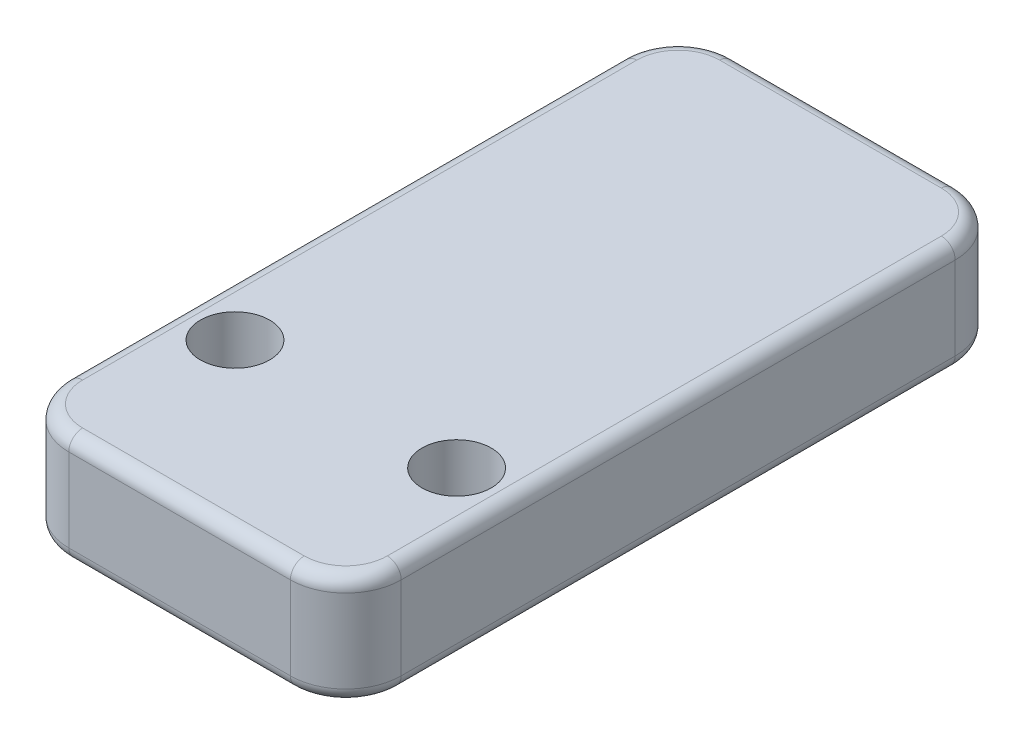
from build123d import *

# Parameters (mm, degrees)
SKETCH1_W           = 24
SKETCH1_H           = 48
BOSS_EXTRUDE1_DEPTH = 8
FILLET2_R           = 4
SKETCH2_R           = 2.5
CUT_EXTRUDE1_DEPTH  = 8
FILLET3_R           = 1


with BuildPart() as part:
    # Sketch1 → Boss-Extrude1 (new body)
    with BuildSketch(Plane(origin=(0, 0, 0), x_dir=(1, 0, 0), z_dir=(0, 1, 0))):
        Rectangle(SKETCH1_W, SKETCH1_H)
    extrude(amount=BOSS_EXTRUDE1_DEPTH)

    # Fillet2
    fillet2_edges = [part.edges().sort_by_distance(p)[0] for p in [
        (-12, 4, 24),
        (-12, 4, -24),
        (12, 4, -24),
        (12, 4, 24),
    ]]
    fillet(fillet2_edges, radius=FILLET2_R)

    # Sketch2 → Cut-Extrude1 (cut)
    with BuildSketch(Plane(origin=(0, 8, 0), x_dir=(1, 0, 0), z_dir=(0, 1, 0))):
        with Locations(Location((8, -12, 0), (0, 0, 270))):
            Circle(SKETCH2_R)
        with Locations(Location((-8, -12, 0), (0, 0, 270))):
            Circle(SKETCH2_R)
    extrude(amount=-CUT_EXTRUDE1_DEPTH, mode=Mode.SUBTRACT)

    # Fillet3
    fillet3_edges = [part.edges().sort_by_distance(p)[0] for p in [
        (0, 0, 24),
        (0, 8, 24),
        (-12, 0, 0),
        (0, 0, -24),
        (12, 0, 0),
        (10.828427125, 0, -22.828427125),
        (10.828427125, 0, 22.828427125),
        (-10.828427125, 0, -22.828427125),
        (-10.828427125, 0, 22.828427125),
        (-12, 8, 0),
        (12, 8, 0),
        (0, 8, -24),
        (10.828427125, 8, -22.828427125),
        (10.828427125, 8, 22.828427125),
        (-10.828427125, 8, -22.828427125),
        (-10.828427125, 8, 22.828427125),
    ]]
    fillet(fillet3_edges, radius=FILLET3_R)


solid = part.part
